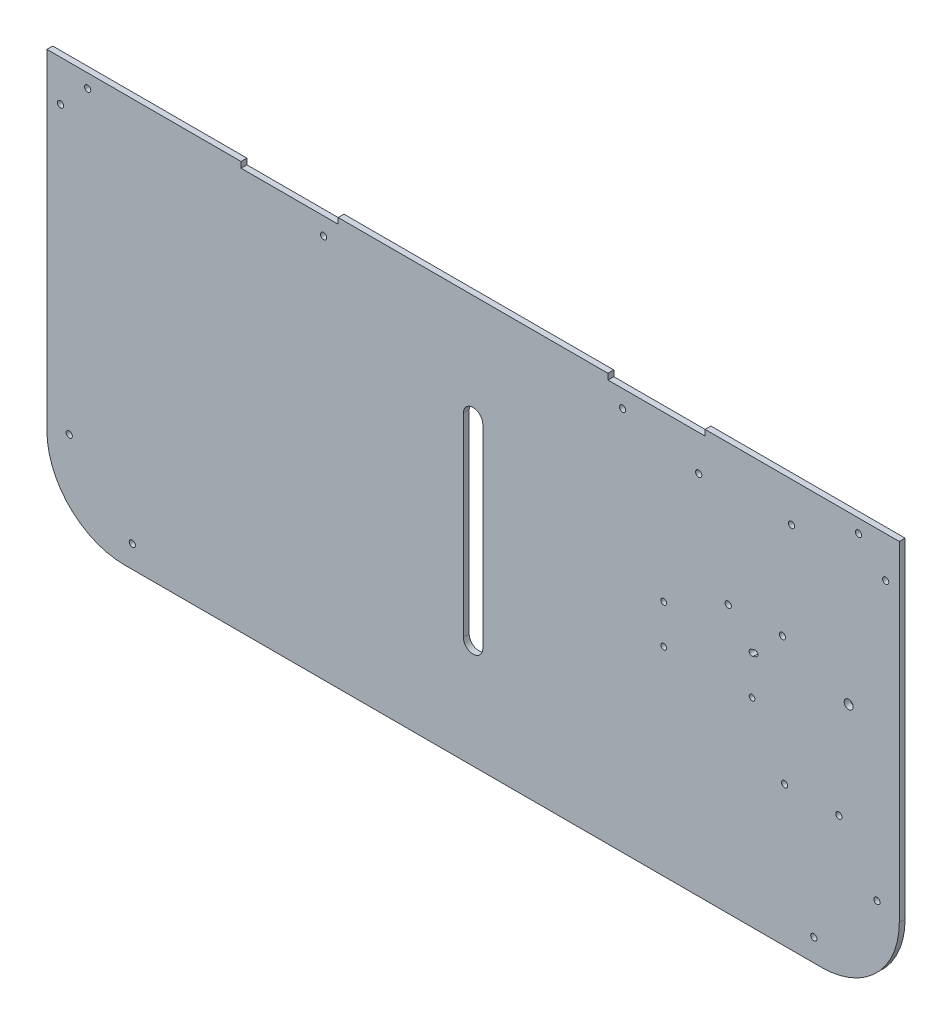
from build123d import *

# Parameters (mm, degrees)
ESQUISSE1_W             = 439
ESQUISSE1_H             = 210
BOSS_EXTRU_1_DEPTH      = 3
ESQUISSE5_R             = 1.477381552
ESQUISSE5_R_2           = 1.598396888
ESQUISSE5_R_3           = 1.5875
ESQUISSE5_R_4           = 2.314661152
ENL_V_MAT_EXTRU_3_DEPTH = 4
ESQUISSE10_W            = 50
ESQUISSE10_H            = 3
ENL_V_MAT_EXTRU_5_DEPTH = 4
ENL_V_MAT_EXTRU_6_DEPTH = 244.33978302
FILLET1_R               = 40
SKETCH1_R               = 1.6
CUT_EXTRUDE1_DEPTH      = 244.33978302
SKETCH2_R               = 1.6
CUT_EXTRUDE2_DEPTH      = 244.33978302
SKETCH3_R               = 1.6
CUT_EXTRUDE3_DEPTH      = 244.33978302
SKETCH4_R               = 1.6
CUT_EXTRUDE4_DEPTH      = 244.33978302
SKETCH5_R               = 1.6
CUT_EXTRUDE5_DEPTH      = 244.33978302
SKETCH7_R               = 1.6
CUT_EXTRUDE6_DEPTH      = 244.33978302
SKETCH8_R               = 1.475
CUT_EXTRUDE7_DEPTH      = 244.33978302


with BuildPart() as part:
    # Esquisse1 → Boss.-Extru.1 (new body)
    with BuildSketch(Plane.XY):
        Rectangle(ESQUISSE1_W, ESQUISSE1_H)
    extrude(amount=BOSS_EXTRU_1_DEPTH)

    # Esquisse5 → Enlèv. mat.-Extru.3 (cut)
    with BuildSketch(Plane(origin=(0, 0, 0), x_dir=(-1, 0, 0), z_dir=(0, 0, -1))):
        with Locations((-145.216701852, 18.010439522)):
            Circle(ESQUISSE5_R)
        with Locations((-160.435580246, -32.780039682)):
            Circle(ESQUISSE5_R_2)
        with Locations((-188.38, -32.79)):
            Circle(ESQUISSE5_R_3)
        with Locations((-193.46, 19.28)):
            Circle(ESQUISSE5_R_4)
    extrude(amount=-ENL_V_MAT_EXTRU_3_DEPTH, mode=Mode.SUBTRACT)

    # Esquisse10 → Enlèv. mat.-Extru.5 (cut)
    with BuildSketch(Plane.XY.offset(3)):
        with Locations((-94.5, 103.5)):
            Rectangle(ESQUISSE10_W, ESQUISSE10_H)
        with Locations((94.5, 103.5)):
            Rectangle(ESQUISSE10_W, ESQUISSE10_H)
    extrude(amount=-ENL_V_MAT_EXTRU_5_DEPTH, mode=Mode.SUBTRACT)

    # Esquisse11 → Enlèv. mat.-Extru.6 (cut, through all)
    with BuildSketch(Plane.XY.offset(3)):
        with BuildLine():
            Line((-5, -50), (-5, 50))
            ThreePointArc((-5, 50), (0, 55), (5, 50))
            Line((5, 50), (5, -50))
            ThreePointArc((5, -50), (0, -55), (-5, -50))
        make_face()
    extrude(amount=-ENL_V_MAT_EXTRU_6_DEPTH, mode=Mode.SUBTRACT)

    # Fillet1
    fillet1_edges = [part.edges().sort_by_distance(p)[0] for p in [
        (219.5, -105, 1.5),
        (-219.5, -105, 1.5),
    ]]
    fillet(fillet1_edges, radius=FILLET1_R)

    # Sketch1 → Cut-Extrude1 (cut, through all)
    with BuildSketch(Plane(origin=(0, 0, 0), x_dir=(-1, 0, 0), z_dir=(0, 0, -1))):
        with Locations((-208, -61)):
            Circle(SKETCH1_R)
    extrude(amount=-CUT_EXTRUDE1_DEPTH, mode=Mode.SUBTRACT)

    # Sketch2 → Cut-Extrude2 (cut, through all)
    with BuildSketch(Plane(origin=(0, 0, 0), x_dir=(-1, 0, 0), z_dir=(0, 0, -1))):
        with Locations((208, -61)):
            Circle(SKETCH2_R)
        with Locations((175.5, -93.5)):
            Circle(SKETCH2_R)
    extrude(amount=-CUT_EXTRUDE2_DEPTH, mode=Mode.SUBTRACT)

    # Sketch3 → Cut-Extrude3 (cut, through all)
    with BuildSketch(Plane(origin=(0, 0, 0), x_dir=(-1, 0, 0), z_dir=(0, 0, -1))):
        with Locations((-175.5, -93.5)):
            Circle(SKETCH3_R)
    extrude(amount=-CUT_EXTRUDE3_DEPTH, mode=Mode.SUBTRACT)

    # Sketch4 → Cut-Extrude4 (cut, through all)
    with BuildSketch(Plane(origin=(0, 0, 0), x_dir=(-1, 0, 0), z_dir=(0, 0, -1))):
        with Locations((-198.5, 98)):
            Circle(SKETCH4_R)
        with Locations((-212.5, 84)):
            Circle(SKETCH4_R)
        with Locations((198.5, 98)):
            Circle(SKETCH4_R)
        with Locations((212.5, 84)):
            Circle(SKETCH4_R)
    extrude(amount=-CUT_EXTRUDE4_DEPTH, mode=Mode.SUBTRACT)

    # Sketch5 → Cut-Extrude5 (cut, through all)
    with BuildSketch(Plane(origin=(0, 0, 0), x_dir=(-1, 0, 0), z_dir=(0, 0, -1))):
        with Locations((77, 93)):
            Circle(SKETCH5_R)
        with Locations((-77, 93)):
            Circle(SKETCH5_R)
    extrude(amount=-CUT_EXTRUDE5_DEPTH, mode=Mode.SUBTRACT)

    # Sketch7 → Cut-Extrude6 (cut, through all)
    with BuildSketch(Plane(origin=(0, 0, 0), x_dir=(-1, 0, 0), z_dir=(0, 0, -1))):
        with Locations((-131.4, 32.8)):
            Circle(SKETCH7_R)
        with Locations((-159.3, 32.8)):
            Circle(SKETCH7_R)
        with Locations((-116.2, 83.6)):
            Circle(SKETCH7_R)
        with Locations((-164, 84.7)):
            Circle(SKETCH7_R)
    extrude(amount=-CUT_EXTRUDE6_DEPTH, mode=Mode.SUBTRACT)

    # Sketch8 → Cut-Extrude7 (cut, through all)
    with BuildSketch(Plane(origin=(0, 0, 0), x_dir=(-1, 0, 0), z_dir=(0, 0, -1))):
        with Locations((-98.175, -2.55)):
            Circle(SKETCH8_R)
        with Locations((-98.175, 17.45)):
            Circle(SKETCH8_R)
        with Locations((-143.675, 17.45)):
            Circle(SKETCH8_R)
        with Locations((-143.675, -2.55)):
            Circle(SKETCH8_R)
    extrude(amount=-CUT_EXTRUDE7_DEPTH, mode=Mode.SUBTRACT)


solid = part.part
